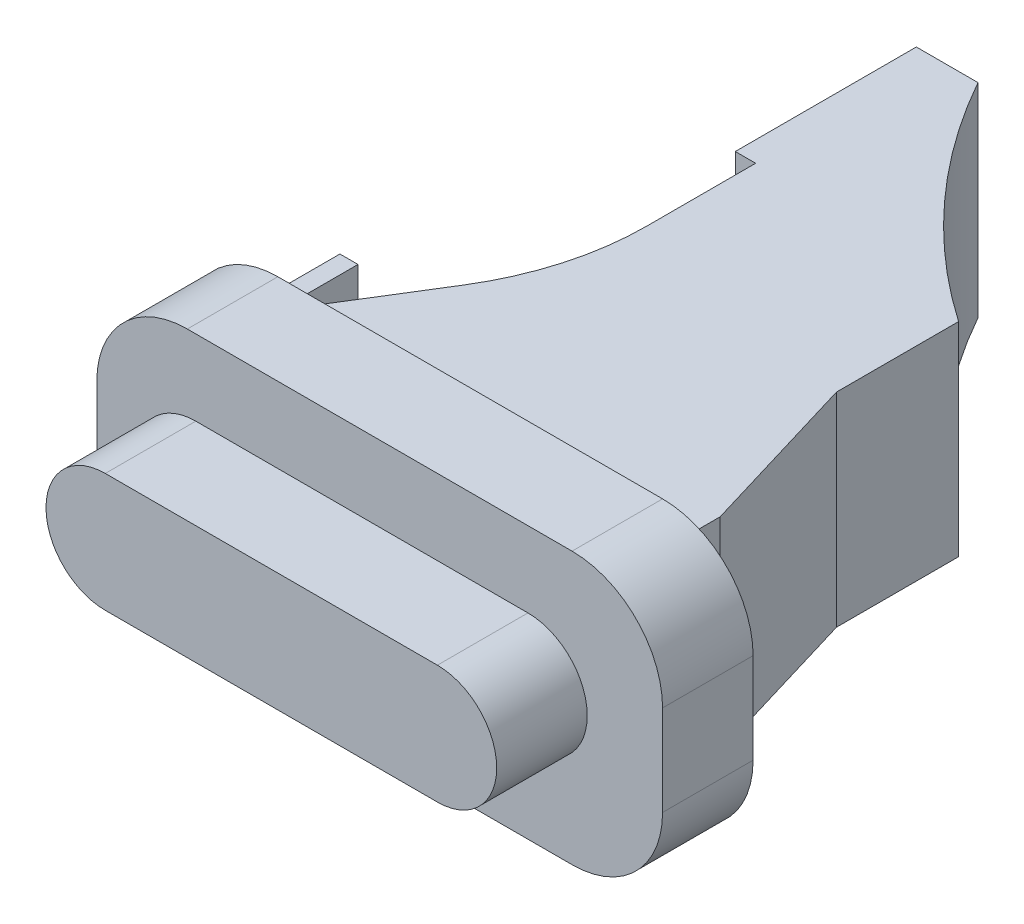
from build123d import *

# Parameters (mm, degrees)
SKETCH1_W            = 15
SKETCH1_H            = 6
BOSS_EXTRUDE1_DEPTH  = 2
BOSS_EXTRUDE2_DEPTH  = 2
BOSS_EXTRUDE3_DEPTH  = 2.25
SKETCH4_W            = 2
SKETCH4_H            = 6
CUT_EXTRUDE1_DEPTH   = 2.5
SKETCH7_W            = 4
SKETCH7_H            = 4.5
BOSS_EXTRUDE4_DEPTH  = 0.45
SKETCH14_W           = 0.5
SKETCH14_H           = 1.65
CUT_EXTRUDE5_DEPTH   = 2
SKETCH8_W            = 0.4
SKETCH8_H            = 3.371005291
BOSS_EXTRUDE5_DEPTH  = 0.75
CUT_EXTRUDE4_DEPTH   = 4.5
SKETCH12_W           = 1.6
SKETCH12_H           = 1.887701739
BOSS_EXTRUDE10_DEPTH = 0.75
FILLET1_R            = 2


with BuildPart() as part:
    # Sketch1 → Boss-Extrude1 (new body)
    with BuildSketch(Plane.XY):
        Rectangle(SKETCH1_W, SKETCH1_H)
    extrude(amount=BOSS_EXTRUDE1_DEPTH)

    # Sketch2 → Boss-Extrude2 (add)
    with BuildSketch(Plane.XY.offset(2)):
        with BuildLine():
            Line((-5.312816027, 1.330227393), (2.025172286, 1.330227393))
            ThreePointArc((2.025172286, 1.330227393), (3.334872121, 0.020527559), (2.025172286, -1.289172275))
            Line((2.025172286, -1.289172275), (-5.312816027, -1.289172275))
            ThreePointArc((-5.312816027, -1.289172275), (-6.622515861, 0.020527559), (-5.312816027, 1.330227393))
        make_face()
    extrude(amount=BOSS_EXTRUDE2_DEPTH)

    # Sketch3 → Boss-Extrude3 (add, symmetric)
    with BuildSketch(Plane(origin=(0, 0, 0), x_dir=(1, 0, 0), z_dir=(0, 1, 0))):
        with BuildLine():
            Line((-5.267009627, 0.659268098), (-4.040664768, 2.641993005))
            ThreePointArc((-4.040664768, 2.641993005), (-3.372127042, 4.157552016), (-3.143471892, 5.798155145))
            Line((-3.143471892, 5.798155145), (-3.143471892, 7.885245495))
            Line((-3.143471892, 7.885245495), (-3.143471892, 12.19944937))
            Line((-3.143471892, 12.19944937), (2.127297199, 12.19944937))
            Line((2.127297199, 12.19944937), (2.127297199, 7.885245495))
            Line((2.127297199, 7.885245495), (2.127297199, 4.714947067))
            Line((2.127297199, 4.714947067), (3.22873188, 1.042912685))
            Line((3.22873188, 1.042912685), (3.22873188, 0))
            Line((3.22873188, 0), (-5.267009627, 0))
            Line((-5.267009627, 0), (-5.267009627, 0.659268098))
        make_face()
    extrude(amount=BOSS_EXTRUDE3_DEPTH, both=True)

    # Sketch4 → Cut-Extrude1 (cut)
    with BuildSketch(Plane(origin=(7.5, 0, 0), x_dir=(0, 0, -1), z_dir=(1, 0, 0))):
        with Locations((-1, 0)):
            Rectangle(SKETCH4_W, SKETCH4_H)
    extrude(amount=-CUT_EXTRUDE1_DEPTH, mode=Mode.SUBTRACT)

    # Sketch7 → Boss-Extrude4 (add)
    with BuildSketch(Plane.ZY.offset(3.143471892)):
        with Locations((-10.19944937, 0)):
            Rectangle(SKETCH7_W, SKETCH7_H)
    extrude(amount=BOSS_EXTRUDE4_DEPTH)

    # Sketch14 → Cut-Extrude5 (cut)
    with BuildSketch(Plane(origin=(0, 0, 0), x_dir=(-1, 0, 0), z_dir=(0, 0, -1))):
        with Locations((5.017009627, 0)):
            Rectangle(SKETCH14_W, SKETCH14_H)
    extrude(amount=CUT_EXTRUDE5_DEPTH, mode=Mode.SUBTRACT)

    # Sketch8 → Boss-Extrude5 (add, symmetric)
    with BuildSketch(Plane(origin=(0, 0, 0), x_dir=(1, 0, 0), z_dir=(0, 1, 0))):
        with Locations((-7.3, 1.685502646)):
            Rectangle(SKETCH8_W, SKETCH8_H)
        with Locations((-5.3, 1.685502646)):
            Rectangle(SKETCH8_W, SKETCH8_H)
    extrude(amount=BOSS_EXTRUDE5_DEPTH, both=True)

    # Sketch11 → Cut-Extrude4 (cut)
    with BuildSketch(Plane(origin=(0, 2.25, 0), x_dir=(1, 0, 0), z_dir=(0, 1, 0))):
        with BuildLine():
            Line((-2.230616354, 12.19944937), (2.127297199, 12.19944937))
            Line((2.127297199, 12.19944937), (2.127297199, 7.412882239))
            ThreePointArc((2.127297199, 7.412882239), (-0.326306783, 9.556114202), (-2.230616354, 12.19944937))
        make_face()
    extrude(amount=-CUT_EXTRUDE4_DEPTH, mode=Mode.SUBTRACT)

    # Sketch12 → Boss-Extrude10 (add, symmetric)
    with BuildSketch(Plane(origin=(0, 0, 0), x_dir=(1, 0, 0), z_dir=(0, 1, 0))):
        with Locations((-6.3, 0.94385087)):
            Rectangle(SKETCH12_W, SKETCH12_H)
    extrude(amount=BOSS_EXTRUDE10_DEPTH, both=True)

    # Fillet1
    fillet1_edges = [part.edges().sort_by_distance(p)[0] for p in [
        (5, -3, 1),
        (5, 3, 1),
        (-7.5, -3, 1),
        (-7.5, 3, 1),
    ]]
    fillet(fillet1_edges, radius=FILLET1_R)


solid = part.part
